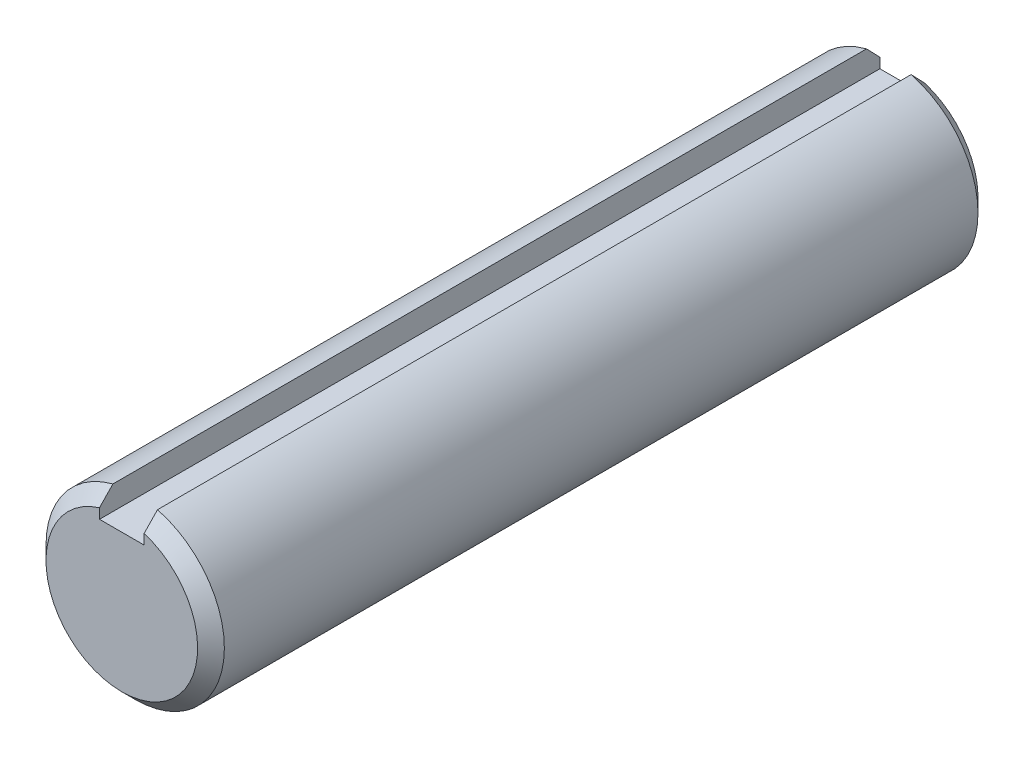
from build123d import *

# Parameters (mm, degrees)
SKETCH1_R           = 4
EXTRUDE1_DEPTH      = 17.5
CHAMFER1_SIZE       = 0.6
EXTRUDE2_DEPTH      = 19.391574158
EXTRUDE2_DEPTH_BACK = 19.391574158
SKETCH3_W           = 2
SKETCH3_H           = 1.2


with BuildPart() as part:
    # Sketch1 → Extrude1 (new, symmetric)
    with BuildSketch(Plane.XY):
        Circle(SKETCH1_R)
    extrude(amount=EXTRUDE1_DEPTH, both=True)

    # Chamfer1
    chamfer1_edges = [part.edges().sort_by_distance(p)[0] for p in [
        (-4, 0, -17.5),
        (-4, 0, 17.5),
    ]]
    chamfer(chamfer1_edges, length=CHAMFER1_SIZE)

    # Sketch3 → Extrude2 (cut, two sides: drawn at the far end of the back side and taken through both)
    with BuildSketch(Plane.XY.offset(-EXTRUDE2_DEPTH_BACK)):
        with Locations((0, 3.4)):
            Rectangle(SKETCH3_W, SKETCH3_H)
    extrude(amount=EXTRUDE2_DEPTH + EXTRUDE2_DEPTH_BACK, mode=Mode.SUBTRACT)


solid = part.part
